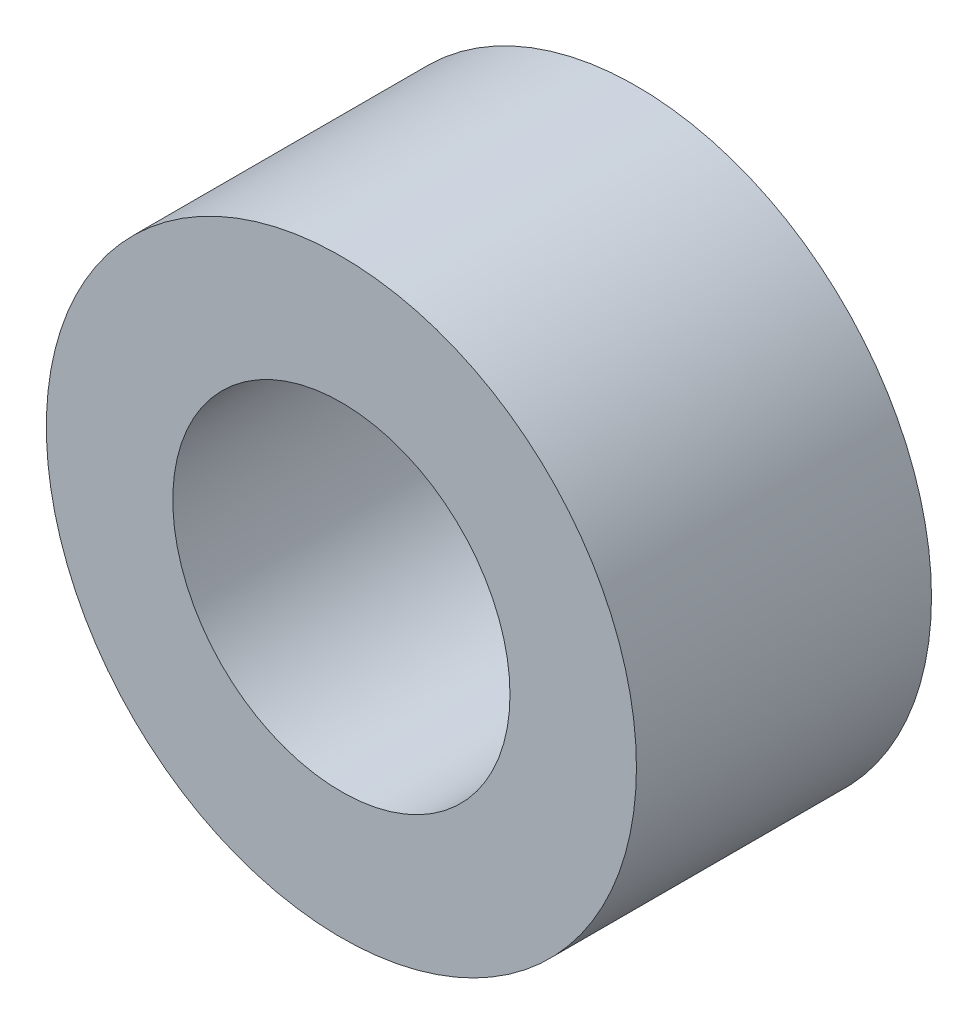
from build123d import *

# Parameters (mm, degrees)
SKETCH1_R           = 7
SKETCH1_R_2         = 4
BOSS_EXTRUDE1_DEPTH = 7


with BuildPart() as part:
    # Sketch1 → Boss-Extrude1 (new body)
    with BuildSketch(Plane.XY):
        Circle(SKETCH1_R)
        Circle(SKETCH1_R_2, mode=Mode.SUBTRACT)
    extrude(amount=BOSS_EXTRUDE1_DEPTH)


solid = part.part
